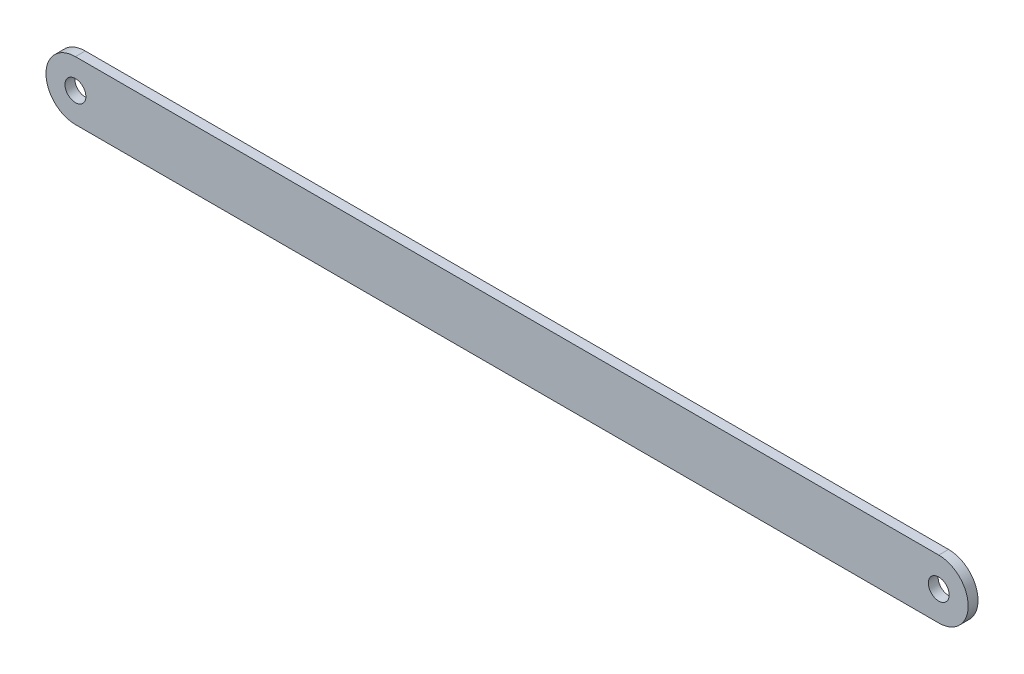
from build123d import *

# Parameters (mm, degrees)
BOSS_EXTRUDE1_DEPTH     = 1.5875
F_1_4_CLEARANCE_HOLE1_D = 6.7564


with BuildPart() as part:
    # Sketch2 → Boss-Extrude1 (new, symmetric)
    with BuildSketch(Plane.XY):
        with BuildLine():
            Line((139.7, -9.525), (-139.7, -9.525))
            ThreePointArc((-139.7, -9.525), (-149.225, 0), (-139.7, 9.525))
            Line((-139.7, 9.525), (139.7, 9.525))
            ThreePointArc((139.7, 9.525), (149.225, 0), (139.7, -9.525))
        make_face()
    extrude(amount=BOSS_EXTRUDE1_DEPTH, both=True)

    # 1/4 Clearance Hole1 (through all)
    with Locations(Plane.XY.offset(1.5875)):
        with Locations((-139.7, 0), (139.7, 0)):
            Hole(F_1_4_CLEARANCE_HOLE1_D / 2)


solid = part.part
